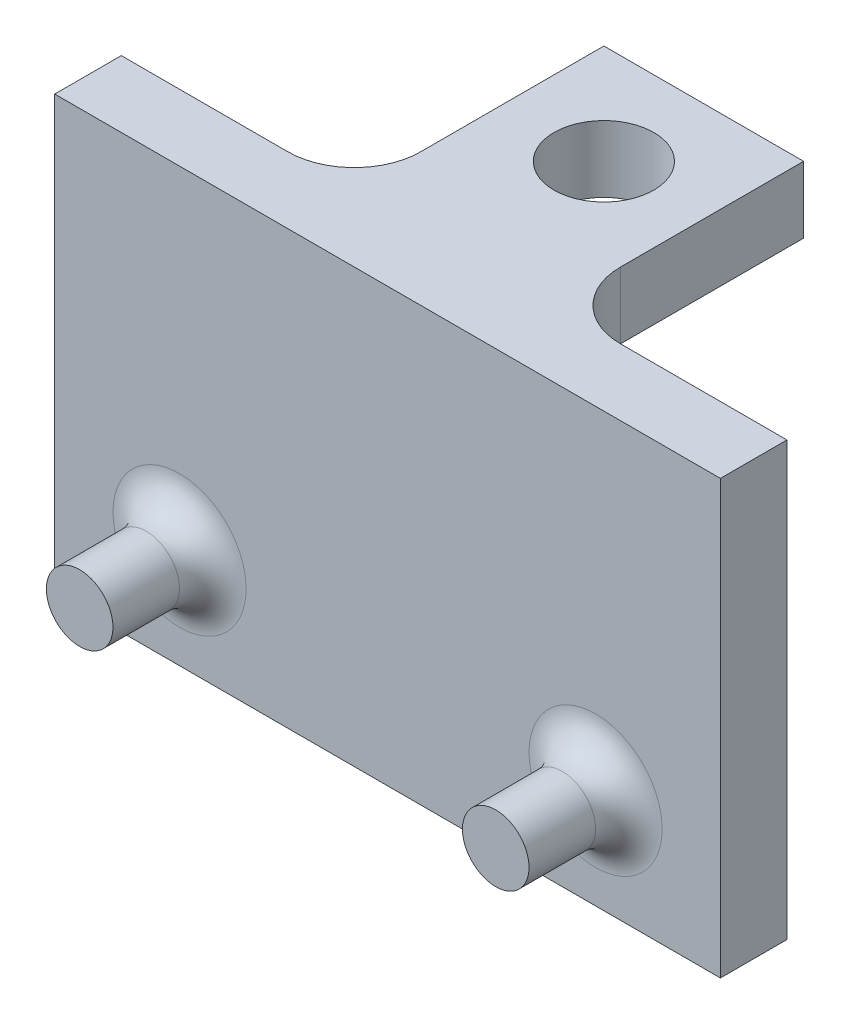
from build123d import *

# Parameters (mm, degrees)
ESQUISSE1_W        = 20
ESQUISSE1_H        = 11
BOSS_EXTRU_1_DEPTH = 2
ESQUISSE2_R        = 1
BOSS_EXTRU_2_DEPTH = 3
CONG_1_R           = 1
ESQUISSE3_R        = 1.5
BOSS_EXTRU_3_DEPTH = 2
CONG_2_R           = 2


with BuildPart() as part:
    # Esquisse1 → Boss.-Extru.1 (new body)
    with BuildSketch(Plane.XY):
        with Locations((10, 5.5)):
            Rectangle(ESQUISSE1_W, ESQUISSE1_H)
    extrude(amount=BOSS_EXTRU_1_DEPTH)

    # Esquisse2 → Boss.-Extru.2 (add)
    with BuildSketch(Plane.XY.offset(2)):
        with Locations(Location((16.25, 3, 0), (0, 0, 180))):
            Circle(ESQUISSE2_R)
        with Locations(Location((3.75, 3, 0), (0, 0, 180))):
            Circle(ESQUISSE2_R)
    extrude(amount=BOSS_EXTRU_2_DEPTH)

    # Congé1
    cong_1_edges = [part.edges().sort_by_distance(p)[0] for p in [
        (17.25, 3, 2),
        (4.75, 3, 2),
    ]]
    fillet(cong_1_edges, radius=CONG_1_R)

    # Esquisse3 → Boss.-Extru.3 (add)
    with BuildSketch(Plane(origin=(0, 11, 0), x_dir=(1, 0, 0), z_dir=(0, 1, 0))):
        Polygon((0, 0), (0, -2), (20, -2), (20, 0), (13, 0), (13, 7.5), (7, 7.5), (7, 0), align=None)
        with Locations(Location((10, 4.5, 0), (0, 0, 270))):
            Circle(ESQUISSE3_R, mode=Mode.SUBTRACT)
    extrude(amount=BOSS_EXTRU_3_DEPTH)

    # Congé2
    cong_2_edges = [part.edges().sort_by_distance(p)[0] for p in [
        (7, 12, 0),
        (13, 12, 0),
    ]]
    fillet(cong_2_edges, radius=CONG_2_R)


solid = part.part
